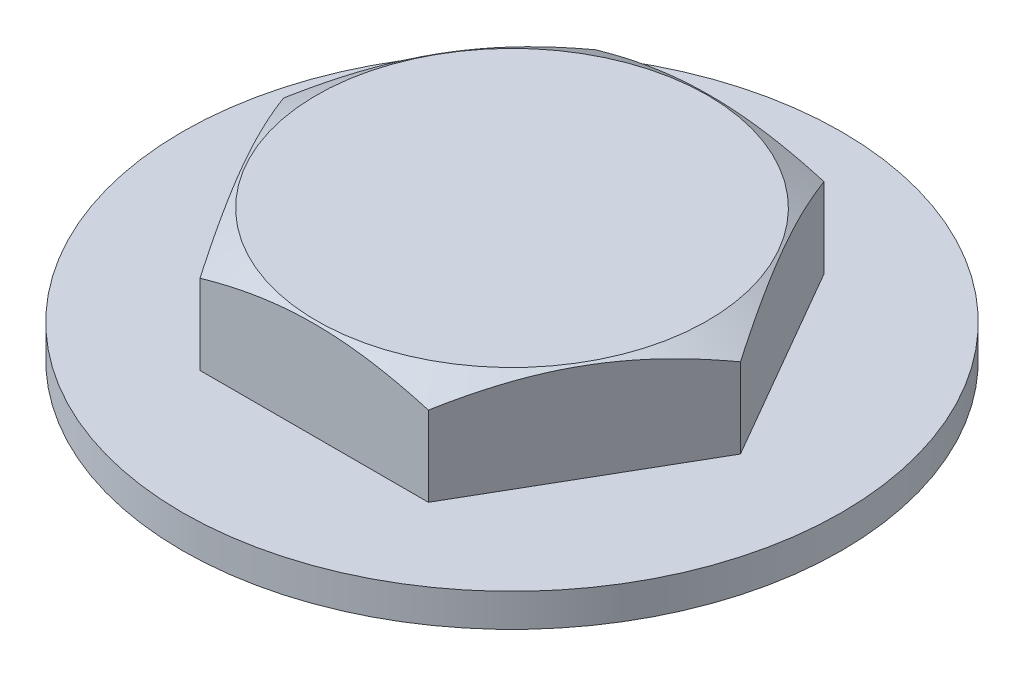
from build123d import *

# Parameters (mm, degrees)
SKETCH_2_R      = 2.5
EXTRUDE_1_DEPTH = 5
SKETCH_3_R      = 10
EXTRUDE_2_DEPTH = 1
EXTRUDE_3_DEPTH = 3
CHAMFER_1_SIZE  = 0.5


with BuildPart() as part:
    # 草图2 → 凸台-拉伸1 (new body)
    with BuildSketch(Plane(origin=(0, 0, 0), x_dir=(1, 0, 0), z_dir=(0, 1, 0))):
        with Locations(Location((0, 0, 0), (0, 0, 270))):
            Circle(SKETCH_2_R)
    extrude(amount=EXTRUDE_1_DEPTH)

    # 草图3 → 凸台-拉伸2 (add)
    with BuildSketch(Plane(origin=(0, 5, 0), x_dir=(1, 0, 0), z_dir=(0, 1, 0))):
        with Locations(Location((0, 0, 0), (0, 0, 270))):
            Circle(SKETCH_3_R)
    extrude(amount=EXTRUDE_2_DEPTH)

    # 草图4 → 凸台-拉伸3 (add)
    with BuildSketch(Plane(origin=(0, 6, 0), x_dir=(1, 0, 0), z_dir=(0, 1, 0))):
        Polygon((3.464101615, 6), (-3.464101615, 6), (-6.92820323, 0), (-3.464101615, -6), (3.464101615, -6), (6.92820323, 0), align=None)
    extrude(amount=EXTRUDE_3_DEPTH)

    # 草图8 → 切除-旋转1 (revolve, cut)
    with BuildSketch(Plane.XY, mode=Mode.PRIVATE) as cut_revolve_1_sk:
        Polygon((-6.92820323, 9), (-5.92820323, 9), (-6.92820323, 8.422649731), align=None)
    revolve(cut_revolve_1_sk.sketch.rotate(Axis((0, 0, 0), (0, 1, 0)), 270), axis=Axis((0, 0, 0), (0, 1, 0)), mode=Mode.SUBTRACT)

    # 倒角1
    chamfer_1_edges = [part.edges().sort_by_distance(p)[0] for p in [
        (0, 0, -2.5),
    ]]
    chamfer(chamfer_1_edges, length=CHAMFER_1_SIZE)


solid = part.part
